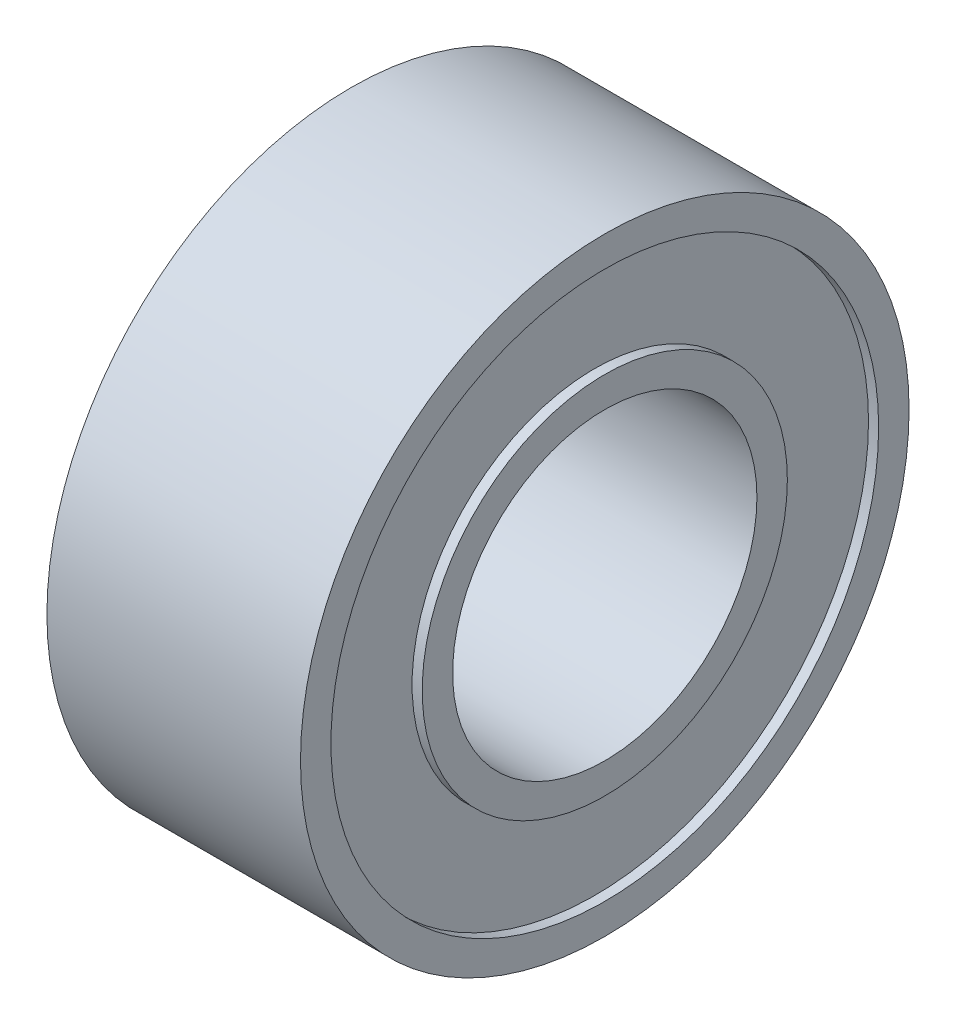
from build123d import *

# Parameters (mm, degrees)
ESQUISSE1_R          = 3
ESQUISSE1_R_2        = 2.7
BOSS_EXTRU_1_DEPTH   = 1.25
ESQUISSE1_R_3        = 1.8
ESQUISSE1_R_4        = 1.5
BOSS_EXTRU_1_2_DEPTH = 1.25
ESQUISSE2_R          = 2.7
ESQUISSE2_R_2        = 1.8
BOSS_EXTRU_2_DEPTH   = 1.15


with BuildPart() as part:
    # Esquisse1 → Boss.-Extru.1 (new, symmetric)
    with BuildSketch(Plane(origin=(0, 0, 0), x_dir=(0, 0, -1), z_dir=(1, 0, 0))):
        Circle(ESQUISSE1_R)
        Circle(ESQUISSE1_R_2, mode=Mode.SUBTRACT)
    extrude(amount=BOSS_EXTRU_1_DEPTH, both=True)



with BuildPart() as body_2:
    # Esquisse1 → Boss.-Extru.1 2 (new, symmetric)
    with BuildSketch(Plane(origin=(0, 0, 0), x_dir=(0, 0, -1), z_dir=(1, 0, 0))):
        Circle(ESQUISSE1_R_3)
        Circle(ESQUISSE1_R_4, mode=Mode.SUBTRACT)
    extrude(amount=BOSS_EXTRU_1_2_DEPTH, both=True)


with BuildPart() as part_1:
    add(part.part)

    add(body_2.part)  # Boss.-Extru.2 merges body 2
    # Esquisse2 → Boss.-Extru.2 (add, symmetric)
    with BuildSketch(Plane(origin=(0, 0, 0), x_dir=(0, 0, -1), z_dir=(1, 0, 0))):
        Circle(ESQUISSE2_R)
        Circle(ESQUISSE2_R_2, mode=Mode.SUBTRACT)
    extrude(amount=BOSS_EXTRU_2_DEPTH, both=True)


solid = part_1.part
